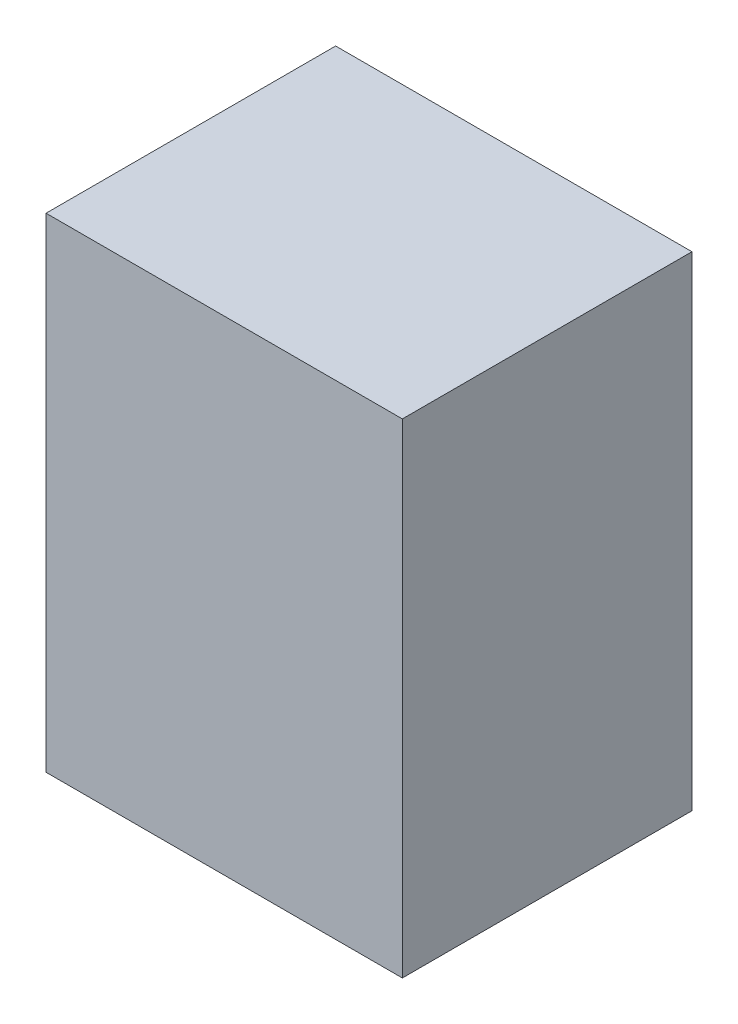
from build123d import *

# Parameters (mm, degrees)
SKETCH1_W                 = 8.92
SKETCH1_H                 = 12.121430126
BOSS_EXTRUDE1_DEPTH       = 7.25
SHELL1_T                  = -0.5
SHELL1_THICKNESS_2_FACE_W = 7.92
SHELL1_THICKNESS_2_FACE_H = 11.121430126
SHELL1_THICKNESS_2_DEPTH  = 0.3


with BuildPart() as part:
    # Sketch1 → Boss-Extrude1 (new body)
    with BuildSketch(Plane.XY):
        with Locations((12.3245, -71.510715063)):
            Rectangle(SKETCH1_W, SKETCH1_H)
    extrude(amount=BOSS_EXTRUDE1_DEPTH)

    # Shell1
    shell1_openings = [part.faces().sort_by_distance(p)[0] for p in [
        (12.3245, -71.510715063, 0),
    ]]
    offset(amount=SHELL1_T, openings=shell1_openings, kind=Kind.INTERSECTION)

    # Shell1 thickness 2 face (on inner face of the shell) → Shell1 thickness 2 (cut)
    with BuildSketch(Plane(origin=(12.3245, -71.510715063, 6.75), x_dir=(1, 0, 0), z_dir=(0, 0, 1))):
        Rectangle(SHELL1_THICKNESS_2_FACE_W, SHELL1_THICKNESS_2_FACE_H)
    extrude(amount=SHELL1_THICKNESS_2_DEPTH, mode=Mode.SUBTRACT)


solid = part.part
